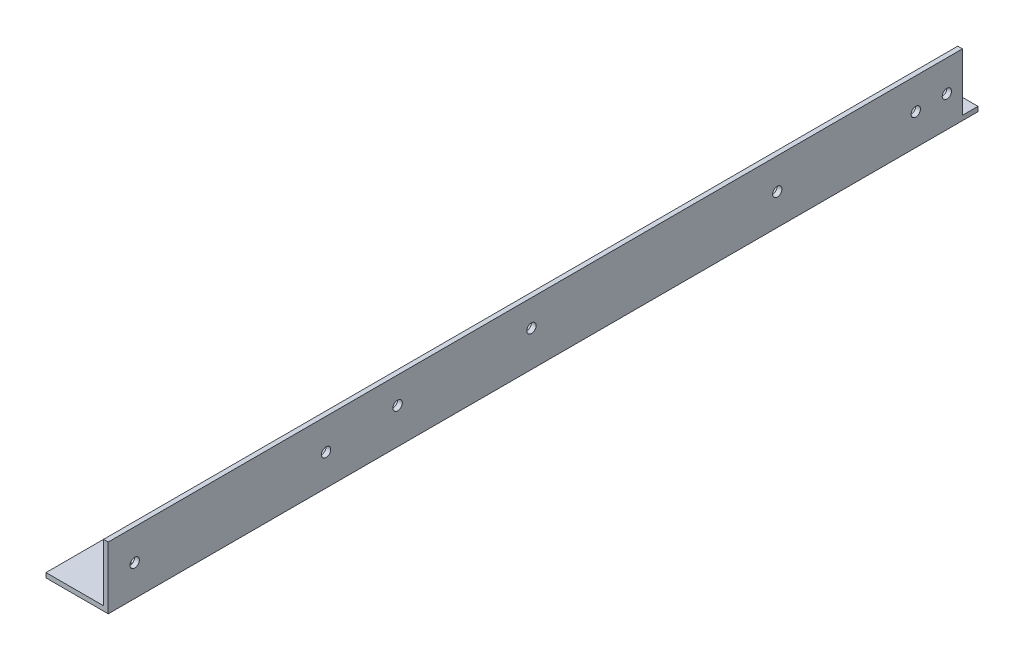
from build123d import *

# Parameters (mm, degrees)
EXTRUSION1_DEPTH = 274.5
ESQUISSE2_R      = 1.5
ESQUISSE2_R_2    = 2
EXTRUSION2_DEPTH = 300
ESQUISSE3_R      = 1.5
EXTRUSION3_DEPTH = 10
ESQUISSE4_W      = 20
ESQUISSE4_H      = 1.5
EXTRUSION4_DEPTH = 5


with BuildPart() as part:
    # Esquisse1 → Extrusion1 (new body)
    with BuildSketch(Plane.XY):
        Polygon((-17.43168638, -13.726631579), (-17.43168638, -15.226631579), (2.56831362, -15.226631579), (2.56831362, 4.773368421), (1.06831362, 4.773368421), (1.06831362, -13.726631579), align=None)
    extrude(amount=EXTRUSION1_DEPTH)

    # Esquisse2 → Extrusion2 (cut)
    with BuildSketch(Plane(origin=(0, -13.726631579, 0), x_dir=(-1, 0, 0), z_dir=(0, 1, 0))):
        with Locations((7.43168638, 204.5)):
            Circle(ESQUISSE2_R)
        with Locations((4.93168638, 4.5)):
            Circle(ESQUISSE2_R_2)
        with Locations((4.93168638, 15.5)):
            Circle(ESQUISSE2_R_2)
        with Locations((4.93168638, 248.5)):
            Circle(ESQUISSE2_R_2)
        with Locations((4.93168638, 259.5)):
            Circle(ESQUISSE2_R_2)
        with Locations((7.43168638, 59.5)):
            Circle(ESQUISSE2_R)
    extrude(amount=-EXTRUSION2_DEPTH, mode=Mode.SUBTRACT)

    # Esquisse3 → Extrusion3 (cut)
    with BuildSketch(Plane(origin=(2.56831362, 0, 0), x_dir=(0, 0, -1), z_dir=(1, 0, 0))):
        with Locations((-266, -5.226631579)):
            Circle(ESQUISSE3_R)
        with Locations((-5, -5.226631579)):
            Circle(ESQUISSE3_R)
        with Locations((-15, -5.226631579)):
            Circle(ESQUISSE3_R)
        with Locations((-59.5, -5.226631579)):
            Circle(ESQUISSE3_R)
        with Locations((-204.5, -5.226631579)):
            Circle(ESQUISSE3_R)
        with Locations((-181.5, -3.726631579)):
            Circle(ESQUISSE3_R)
        with Locations((-138.5, -3.726631579)):
            Circle(ESQUISSE3_R)
    extrude(amount=-EXTRUSION3_DEPTH, mode=Mode.SUBTRACT)

    # Esquisse4 → Extrusion4 (add)
    with BuildSketch(Plane(origin=(0, 0, 0), x_dir=(-1, 0, 0), z_dir=(0, 0, -1))):
        with Locations((7.43168638, -14.476631579)):
            Rectangle(ESQUISSE4_W, ESQUISSE4_H)
    extrude(amount=EXTRUSION4_DEPTH)


solid = part.part
